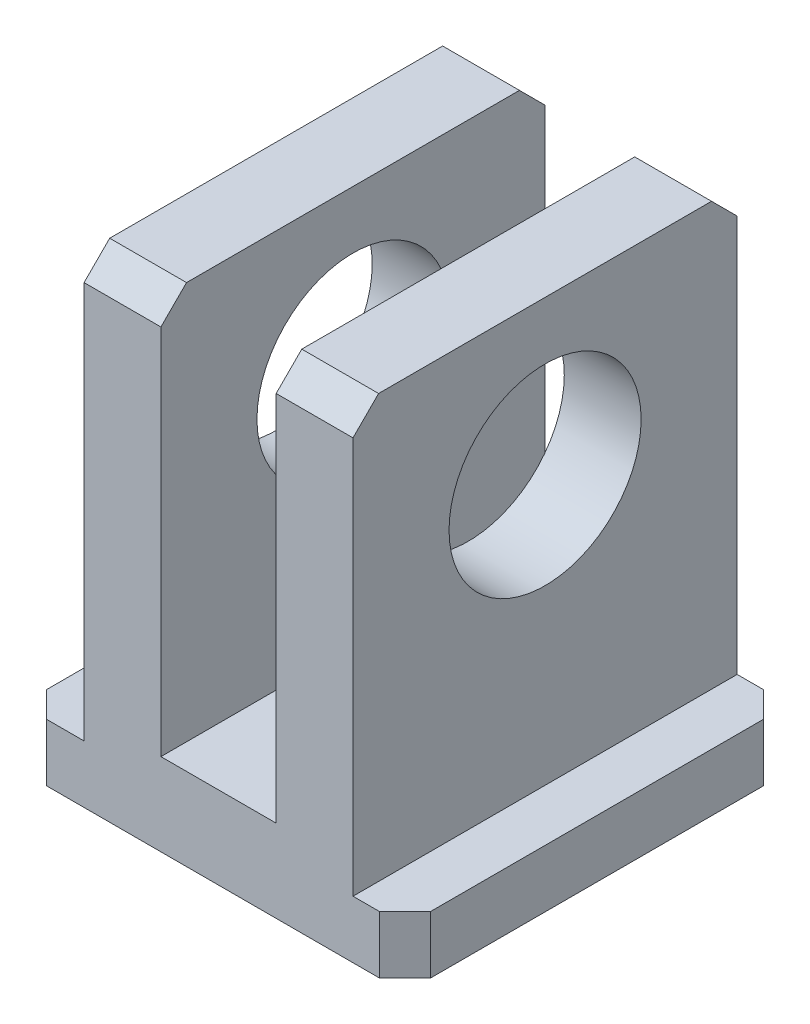
from build123d import *

# Parameters (mm, degrees)
SKETCH_1_W          = 30
SKETCH_1_H          = 37.5
EXTRUDE_2_DEPTH     = 15
SKETCH_3_W          = 4.5
SKETCH_3_H          = 31.058772458
SKETCH_3_W_2        = 4.938881881
SKETCH_3_H_2        = 33
SKETCH_3_W_3        = 4.061118119
CUT_EXTRUDE_1_DEPTH = 51.311529494
SKETCH_4_R          = 7.5
CUT_EXTRUDE_2_DEPTH = 55.169268422
CHAMFER_1_SIZE      = 2


with BuildPart() as part:
    # 草图1 → 凸台-拉伸2 (new, symmetric)
    with BuildSketch(Plane(origin=(0, 0, 0), x_dir=(0, 0, -1), z_dir=(1, 0, 0))):
        with Locations((15, 18.75)):
            Rectangle(SKETCH_1_W, SKETCH_1_H)
    extrude(amount=EXTRUDE_2_DEPTH, both=True)

    # 草图3 → 切除-拉伸1 (cut, through all)
    with BuildSketch(Plane.XY):
        with Locations((-1.811118119, 21.970613771)):
            Rectangle(SKETCH_3_W, SKETCH_3_H)
        with Locations((2.688881881, 21.970613771)):
            Rectangle(SKETCH_3_W, SKETCH_3_H)
        with Locations((-12.53055906, 21)):
            Rectangle(SKETCH_3_W_2, SKETCH_3_H_2)
        with Locations((12.969440941, 21)):
            Rectangle(SKETCH_3_W_3, SKETCH_3_H_2)
    extrude(amount=-CUT_EXTRUDE_1_DEPTH, mode=Mode.SUBTRACT)

    # 草图4 → 切除-拉伸2 (cut, through all)
    with BuildSketch(Plane.ZY.offset(10.061118119)):
        with Locations((-15, 25.5)):
            Circle(SKETCH_4_R)
    extrude(amount=-CUT_EXTRUDE_2_DEPTH, mode=Mode.SUBTRACT)

    # 倒角1
    chamfer_1_edges = [part.edges().sort_by_distance(p)[0] for p in [
        (15, 2.25, -30),
        (-15, 2.25, 0),
        (15, 2.25, 0),
        (7.938881881, 37.5, 0),
        (-7.061118119, 37.5, 0),
        (7.938881881, 37.5, -30),
        (-7.061118119, 37.5, -30),
        (-15, 2.25, -30),
    ]]
    chamfer(chamfer_1_edges, length=CHAMFER_1_SIZE)


solid = part.part
